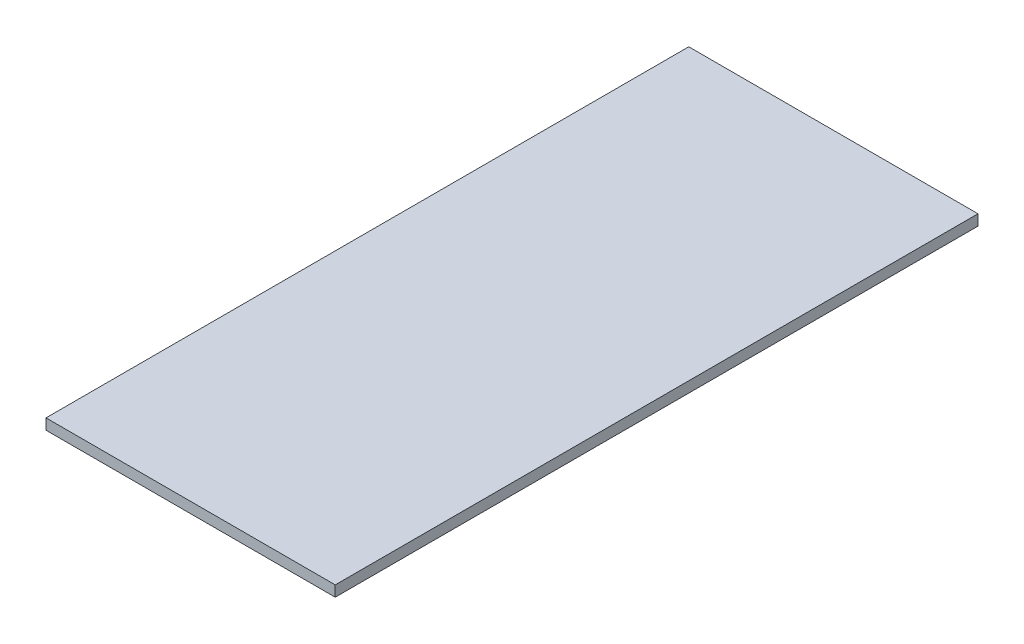
from build123d import *

# Parameters (mm, degrees)
SKETCH_1_W      = 81
SKETCH_1_H      = 180
EXTRUDE_1_DEPTH = 3


with BuildPart() as part:
    # 스케치1 → 보스-돌출1 (new body)
    with BuildSketch(Plane(origin=(0, 0, 0), x_dir=(1, 0, 0), z_dir=(0, 1, 0))):
        Rectangle(SKETCH_1_W, SKETCH_1_H)
    extrude(amount=EXTRUDE_1_DEPTH)


solid = part.part
